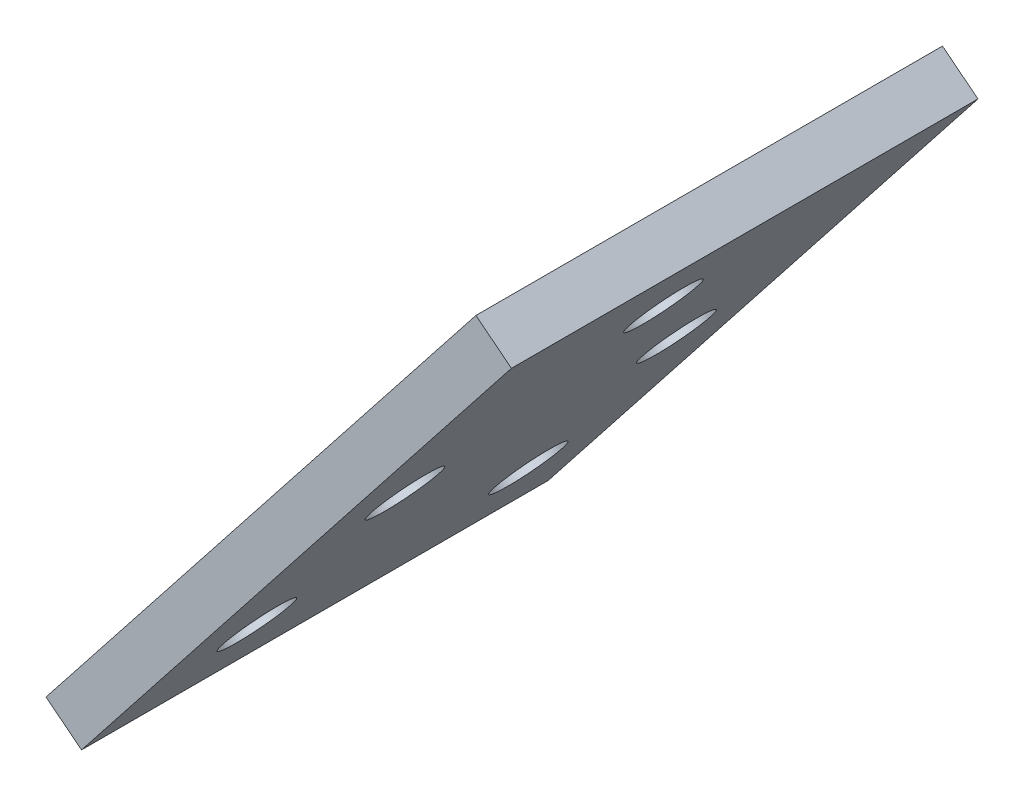
from build123d import *

# Parameters (mm, degrees)
SKETCH2_W           = 65.46462614
SKETCH2_H           = 97.449626127
SKETCH2_R           = 4.7625
BOSS_EXTRUDE1_DEPTH = 6.35


with BuildPart() as part:
    # Sketch2 → Boss-Extrude1 (new body)
    with BuildSketch(Plane(origin=(2141.629370819, 528.030131074, 512.209663273), x_dir=(0, 0, 1), z_dir=(-0.7853819908593475, 0.6190114121999754, 0))):
        with Locations((0, -30.750077279)):
            Rectangle(SKETCH2_W, SKETCH2_H)
        with Locations(Location((0, -0.452051751, 0), (0, 0, 270))):
            Circle(SKETCH2_R, mode=Mode.SUBTRACT)
        with Locations(Location((-19.05, -28.264238369, 0), (0, 0, 270))):
            Circle(SKETCH2_R, mode=Mode.SUBTRACT)
        with Locations(Location((19.05, -28.264238369, 0), (0, 0, 270))):
            Circle(SKETCH2_R, mode=Mode.SUBTRACT)
        with Locations(Location((19.05, -61.848766595, 0), (0, 0, 270))):
            Circle(SKETCH2_R, mode=Mode.SUBTRACT)
        with Locations(Location((-19.05, -61.848766595, 0), (0, 0, 270))):
            Circle(SKETCH2_R, mode=Mode.SUBTRACT)
    extrude(amount=BOSS_EXTRUDE1_DEPTH)


solid = part.part
